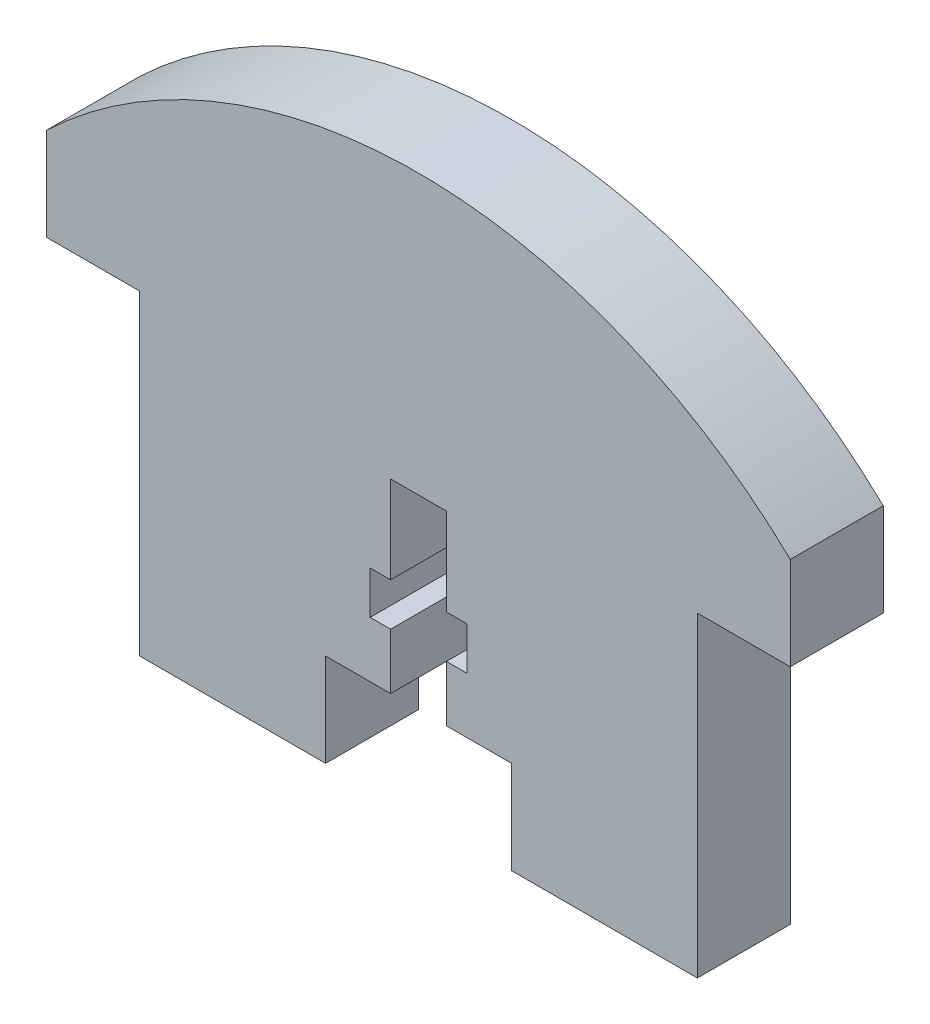
from build123d import *

# Parameters (mm, degrees)
BOSS_EXTRU_1_DEPTH = 5


with BuildPart() as part:
    # Esquisse1 → Boss.-Extru.1 (new body)
    with BuildSketch(Plane.XY):
        with BuildLine():
            Line((-1.5, 3), (-1.5, 0))
            Line((-1.5, 0), (-5, 0))
            Line((-5, 0), (-5, -5))
            Line((-5, -5), (-15, -5))
            Line((-15, -5), (-15, 0))
            Line((-15, 0), (-15, 12))
            Line((-15, 12), (-20, 12))
            Line((-20, 12), (-20, 17))
            ThreePointArc((-20, 17), (0, 25), (20, 17))
            Line((20, 17), (20, 12))
            Line((20, 12), (15, 12))
            Line((15, 12), (15, 0))
            Line((15, 0), (15, -5))
            Line((15, -5), (5, -5))
            Line((5, -5), (5, 0))
            Line((5, 0), (1.5, 0))
            Line((1.5, 0), (1.5, 3))
            Line((1.5, 3), (2.6, 3))
            Line((2.6, 3), (2.6, 5.3))
            Line((2.6, 5.3), (1.5, 5.3))
            Line((1.5, 5.3), (1.5, 10))
            Line((1.5, 10), (-1.5, 10))
            Line((-1.5, 10), (-1.5, 5.3))
            Line((-1.5, 5.3), (-2.6, 5.3))
            Line((-2.6, 5.3), (-2.6, 3))
            Line((-2.6, 3), (-1.5, 3))
        make_face()
    extrude(amount=BOSS_EXTRU_1_DEPTH)


solid = part.part
